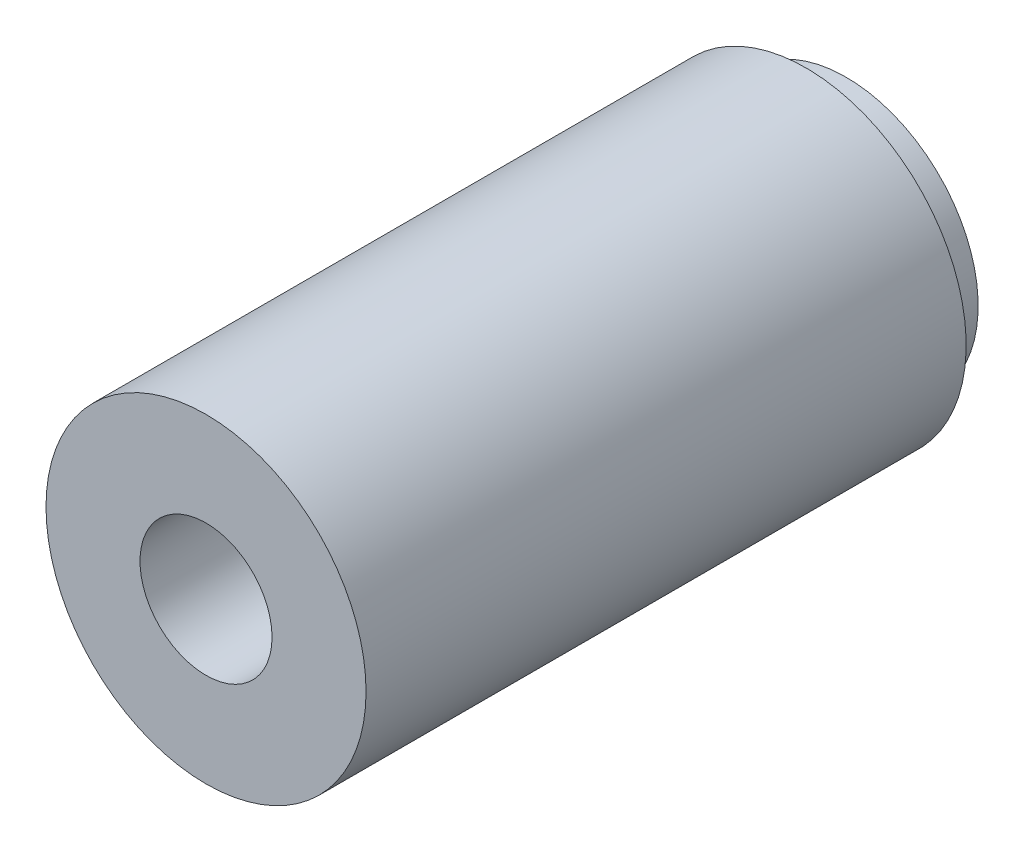
from build123d import *

# Parameters (mm, degrees)
ESQUISSE1_R             = 4
BOSS_EXTRU_1_DEPTH      = 16
TROU_TARAUD_M41_D       = 3.3
TROU_TARAUD_M41_DEPTH   = 8
TROU_TARAUD_M41_TIP     = 0.991420021
ESQUISSE4_R             = 2.5
ENL_V_MAT_EXTRU_1_DEPTH = 8
ESQUISSE5_OUTSIDE_W     = 13.92
ESQUISSE5_OUTSIDE_H     = 13.92
ESQUISSE5_OUTSIDE_R     = 3.3
ENL_V_MAT_EXTRU_2_DEPTH = 1


with BuildPart() as part:
    # Esquisse1 → Boss.-Extru.1 (new body)
    with BuildSketch(Plane.XY):
        Circle(ESQUISSE1_R)
    extrude(amount=BOSS_EXTRU_1_DEPTH)

    # Trou taraudé M41
    with Locations(Plane.XY.offset(16)):
        with Locations((0, 0)):
            Hole(TROU_TARAUD_M41_D / 2, depth=TROU_TARAUD_M41_DEPTH)
            with Locations((0, 0, -(TROU_TARAUD_M41_DEPTH + TROU_TARAUD_M41_TIP / 2))):  # 118° drill point
                Cone(0, TROU_TARAUD_M41_D / 2, TROU_TARAUD_M41_TIP, mode=Mode.SUBTRACT)

    # Esquisse4 → Enlèv. mat.-Extru.1 (cut)
    with BuildSketch(Plane(origin=(0, 0, 0), x_dir=(-1, 0, 0), z_dir=(0, 0, -1))):
        Circle(ESQUISSE4_R)
    extrude(amount=-ENL_V_MAT_EXTRU_1_DEPTH, mode=Mode.SUBTRACT)

    # Esquisse5 outside → Enlèv. mat.-Extru.2 (cut)
    with BuildSketch(Plane(origin=(0, 0, 0), x_dir=(-1, 0, 0), z_dir=(0, 0, -1))):
        Rectangle(ESQUISSE5_OUTSIDE_W, ESQUISSE5_OUTSIDE_H)
        Circle(ESQUISSE5_OUTSIDE_R, mode=Mode.SUBTRACT)
    extrude(amount=-ENL_V_MAT_EXTRU_2_DEPTH, mode=Mode.SUBTRACT)


solid = part.part
